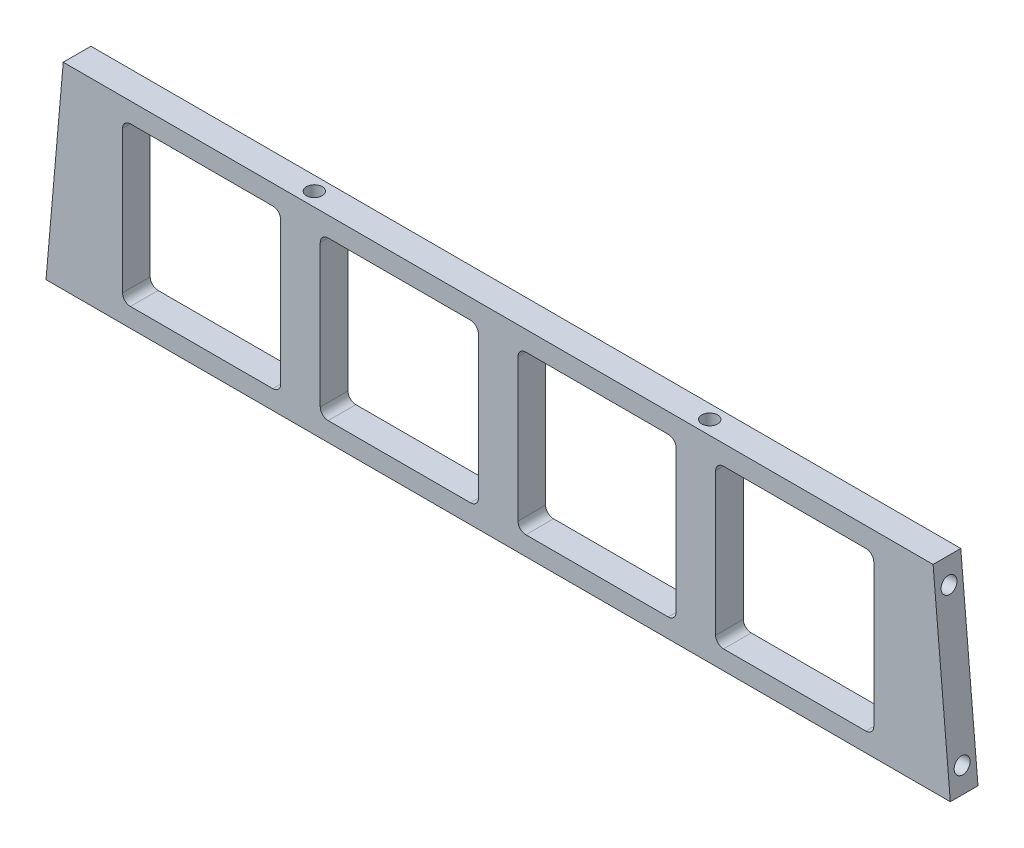
from build123d import *

# Parameters (mm, degrees)
EXTRUDE_1_DEPTH     = 7
SKETCH_2_R          = 2
CUT_EXTRUDE_1_DEPTH = 10
SKETCH_3_W          = 40
SKETCH_3_H          = 40
CUT_EXTRUDE_2_DEPTH = 7
FILLET_1_R          = 2
FILLET_2_R          = 2
SKETCH_4_R          = 2
CUT_EXTRUDE_3_DEPTH = 90


with BuildPart() as part:
    # 草图1 → 凸台-拉伸1 (new body)
    with BuildSketch(Plane.XY):
        Polygon((0, 0), (220, 0), (224.357787137, -49.809734905), (-4.357787137, -49.809734905), align=None)
    extrude(amount=EXTRUDE_1_DEPTH)

    # 草图2 → 切除-拉伸1 (cut)
    with BuildSketch(Plane(origin=(0, 0, 0), x_dir=(0, 0, 1), z_dir=(-0.9961946980917453, 0.08715574274766177, 0))):
        with Locations(Location((3.5, -6, 0), (0, 0, 270))):
            Circle(SKETCH_2_R)
        with Locations(Location((3.5, -44, 0), (0, 0, 270))):
            Circle(SKETCH_2_R)
    cut_extrude_1 = extrude(amount=-CUT_EXTRUDE_1_DEPTH, mode=Mode.SUBTRACT)

    # 镜向1: 切除-拉伸1 across plane
    add(cut_extrude_1.mirror(Plane(origin=(110, 0, 0), x_dir=(0, 0, 1), z_dir=(1, 0, 0))), mode=Mode.SUBTRACT)

    # 草图3 → 切除-拉伸2 (cut)
    with BuildSketch(Plane(origin=(0, 0, 0), x_dir=(-1, 0, 0), z_dir=(0, 0, -1))):
        with Locations((-185, -25)):
            Rectangle(SKETCH_3_W, SKETCH_3_H)
        with Locations((-135, -25)):
            Rectangle(SKETCH_3_W, SKETCH_3_H)
        with Locations((-35, -25)):
            Rectangle(SKETCH_3_W, SKETCH_3_H)
        with Locations((-85, -25)):
            Rectangle(SKETCH_3_W, SKETCH_3_H)
    extrude(amount=-CUT_EXTRUDE_2_DEPTH, mode=Mode.SUBTRACT)

    # 圆角1
    fillet_1_edges = [part.edges().sort_by_distance(p)[0] for p in [
        (205, -45, 3.5),
        (205, -5, 3.5),
        (165, -5, 3.5),
        (165, -45, 3.5),
        (115, -45, 3.5),
        (155, -45, 3.5),
        (155, -5, 3.5),
        (115, -5, 3.5),
    ]]
    fillet(fillet_1_edges, radius=FILLET_1_R)

    # 圆角2
    fillet_2_edges = [part.edges().sort_by_distance(p)[0] for p in [
        (15, -5, 3.5),
        (15, -45, 3.5),
        (55, -45, 3.5),
        (55, -5, 3.5),
        (65, -45, 3.5),
        (105, -45, 3.5),
        (105, -5, 3.5),
        (65, -5, 3.5),
    ]]
    fillet(fillet_2_edges, radius=FILLET_2_R)

    # 草图4 → 切除-拉伸3 (cut)
    with BuildSketch(Plane(origin=(0, 0, 0), x_dir=(1, 0, 0), z_dir=(0, 1, 0))):
        with Locations(Location((60, -3.5, 0), (0, 0, 270))):
            Circle(SKETCH_4_R)
        with Locations(Location((160, -3.5, 0), (0, 0, 270))):
            Circle(SKETCH_4_R)
    extrude(amount=-CUT_EXTRUDE_3_DEPTH, mode=Mode.SUBTRACT)


solid = part.part
